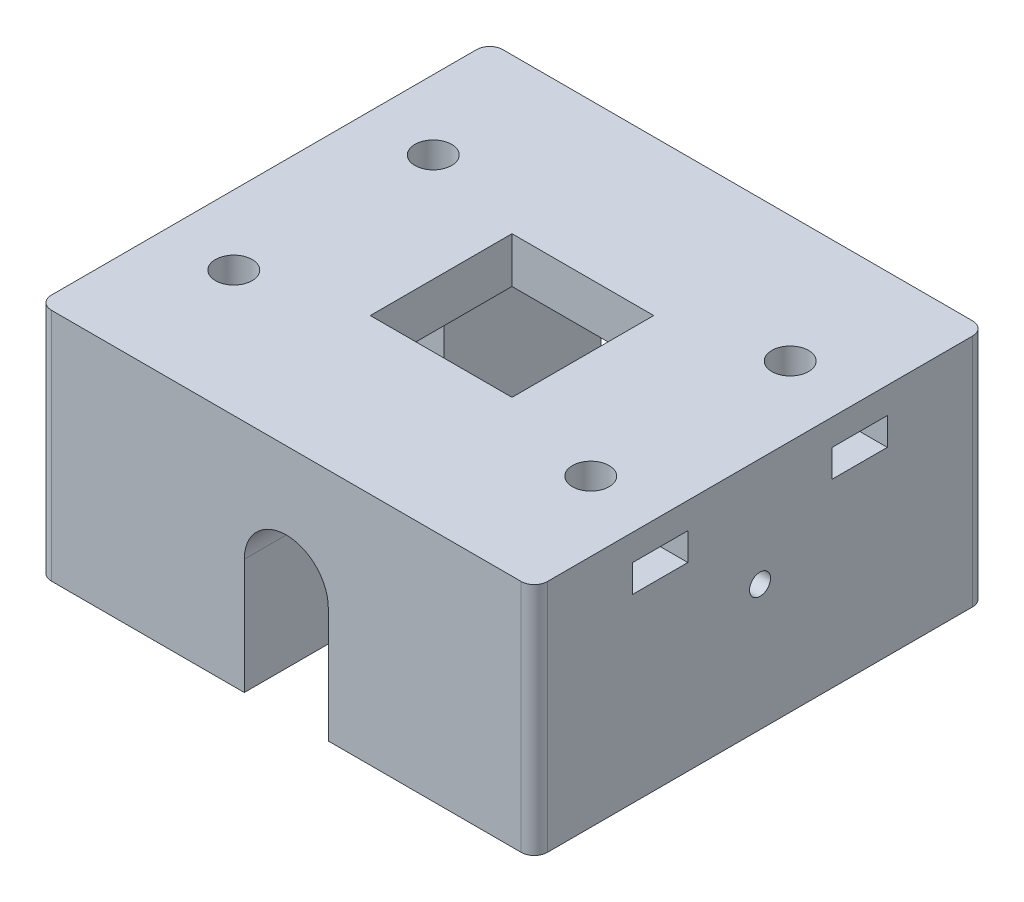
from build123d import *

# Parameters (mm, degrees)
BOSS_EXTRUDE1_DEPTH  = 36
M3_CLEARANCE_HOLE1_D = 4
SKETCH6_W            = 94.5
SKETCH6_H            = 86
SKETCH6_W_2          = 27
SKETCH6_H_2          = 27
BOSS_EXTRUDE2_DEPTH  = 8.7
FILLET1_R            = 2.5
SKETCH2_3_W          = 3.25
SKETCH2_3_H          = 6.25
CUT_EXTRUDE1_DEPTH   = 27
CUT_EXTRUDE2_DEPTH   = 108.826956277
M6_CLEARANCE_HOLE1_D = 7
SKETCH12_W           = 10.5
SKETCH12_H           = 5.25
CUT_EXTRUDE4_DEPTH   = 22


with BuildPart() as part:
    # Sketch2 → Boss-Extrude1 (new body)
    with BuildSketch(Plane(origin=(0, 0, 0), x_dir=(1, 0, 0), z_dir=(0, 1, 0))):
        Polygon((-33.75, 13), (-26, 13), (-26, 43), (-47.25, 43), (-47.25, -43), (47.25, -43), (47.25, 43), (26, 43), (26, 13), (33.75, 13), (33.75, -13), (15.75, -13), (15.75, -15), (-15.75, -15), (-15.75, -13), (-33.75, -13), align=None)
    extrude(amount=BOSS_EXTRUDE1_DEPTH)

    # M3 Clearance Hole1 (through all)
    with Locations(Plane(origin=(47.25, 0, 0), x_dir=(0, 0, -1), z_dir=(1, 0, 0))):
        with Locations((0, 24)):
            Hole(M3_CLEARANCE_HOLE1_D / 2)

    # Sketch6 → Boss-Extrude2 (add)
    with BuildSketch(Plane(origin=(0, 36, 0), x_dir=(1, 0, 0), z_dir=(0, 1, 0))):
        Rectangle(SKETCH6_W, SKETCH6_H)
        Rectangle(SKETCH6_W_2, SKETCH6_H_2, mode=Mode.SUBTRACT)
    extrude(amount=BOSS_EXTRUDE2_DEPTH)

    # Fillet1
    fillet1_edges = [part.edges().sort_by_distance(p)[0] for p in [
        (47.25, 22.35, -43),
        (47.25, 22.35, 43),
        (-47.25, 22.35, 43),
        (-47.25, 22.35, -43),
    ]]
    fillet(fillet1_edges, radius=FILLET1_R)

    # Sketch2<3> → Cut-Extrude1 (cut)
    with BuildSketch(Plane(origin=(0, 0, 0), x_dir=(1, 0, 0), z_dir=(0, 1, 0))):
        with Locations((-40.5, 0)):
            Rectangle(SKETCH2_3_W, SKETCH2_3_H)
        with Locations((40.5, 0)):
            Rectangle(SKETCH2_3_W, SKETCH2_3_H)
    extrude(amount=CUT_EXTRUDE1_DEPTH, mode=Mode.SUBTRACT)

    # Sketch8 → Cut-Extrude2 (cut, through all)
    with BuildSketch(Plane.XY.offset(43)):
        with BuildLine():
            Line((-8, 22), (-8, 0))
            Line((-8, 0), (8, 0))
            Line((8, 0), (8, 22))
            ThreePointArc((8, 22), (0, 30), (-8, 22))
        make_face()
    extrude(amount=-CUT_EXTRUDE2_DEPTH, mode=Mode.SUBTRACT)

    # M6 Clearance Hole1 (through all)
    with Locations(Plane(origin=(0, 44.7, 0), x_dir=(1, 0, 0), z_dir=(0, 1, 0))):
        with Locations((-34, 19), (34, 19), (34, -19), (-34, -19)):
            Hole(M6_CLEARANCE_HOLE1_D / 2)

    # Sketch12 → Cut-Extrude4 (cut)
    with BuildSketch(Plane(origin=(47.25, 0, 0), x_dir=(0, 0, -1), z_dir=(1, 0, 0))):
        with Locations((-19, 37.075)):
            Rectangle(SKETCH12_W, SKETCH12_H)
        with Locations((19, 37.075)):
            Rectangle(SKETCH12_W, SKETCH12_H)
    cut_extrude4 = extrude(amount=-CUT_EXTRUDE4_DEPTH, mode=Mode.SUBTRACT)

    # Mirror2: Cut-Extrude4 across plane
    add(cut_extrude4.mirror(Plane(origin=(0, 0, 0), x_dir=(0, 0, 1), z_dir=(1, 0, 0))), mode=Mode.SUBTRACT)


solid = part.part
